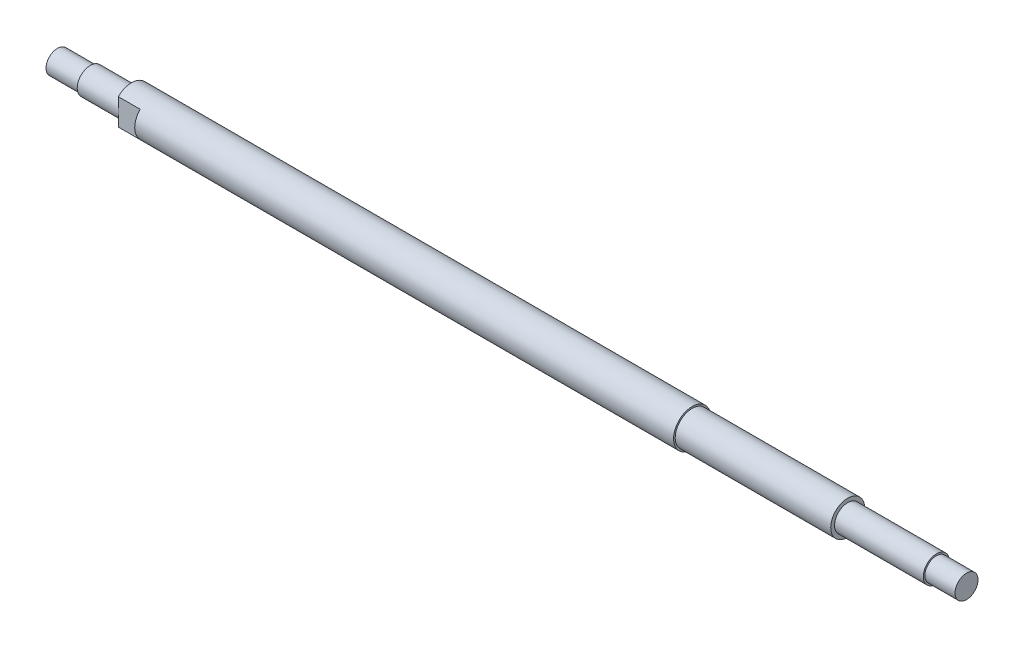
from build123d import *

# Parameters (mm, degrees)
CUT_EXTRUDE1_REACH             = 162.072
SKETCH2_W                      = 4
SKETCH2_H                      = 1
CUT_EXTRUDE1_DIRECTION_2_REACH = 162.072


with BuildPart() as part:
    # Sketch1 → Revolve1 (revolve)
    with BuildSketch(Plane(origin=(0, 0, 0), x_dir=(1, 0, 0), z_dir=(0, 1, 0)), mode=Mode.PRIVATE) as revolve1_sk:
        Polygon((0, 2.4), (0, 2.1), (-6, 2.1), (-6, 0), (160, 0), (160, 2.1), (154.5, 2.1), (154.5, 2.4), (138.3, 2.4), (138.3, 3.1), (109.9, 3.1), (109.9, 3.4), (7.5, 3.4), (7.5, 2.4), align=None)
    revolve(revolve1_sk.sketch.rotate(Axis((-12.266501292, 0, 0), (1, 0, 0)), 180), axis=Axis((-12.266501292, 0, 0), (1, 0, 0)))

    # Sketch2 → Cut-Extrude1 (cut, up to next)
    with BuildSketch(Plane(origin=(0, 0, 0), x_dir=(1, 0, 0), z_dir=(0, 1, 0)), mode=Mode.PRIVATE) as cut_extrude1_sk1:
        with Locations((9.5, 2.9)):
            Rectangle(SKETCH2_W, SKETCH2_H)
    cut_extrude1_tool1 = extrude(cut_extrude1_sk1.sketch, amount=-CUT_EXTRUDE1_REACH, mode=Mode.PRIVATE) & part.part
    # Sketch2 → Cut-Extrude1 (cut, up to next)
    with BuildSketch(Plane(origin=(0, 0, 0), x_dir=(1, 0, 0), z_dir=(0, 1, 0)), mode=Mode.PRIVATE) as cut_extrude1_sk2:
        with Locations((9.5, -2.9)):
            Rectangle(SKETCH2_W, SKETCH2_H)
    cut_extrude1_tool2 = extrude(cut_extrude1_sk2.sketch, amount=-CUT_EXTRUDE1_REACH, mode=Mode.PRIVATE) & part.part
    add(cut_extrude1_tool1.solids().sort_by_distance((9.5, 0, -2.9))[0], mode=Mode.SUBTRACT)
    add(cut_extrude1_tool2.solids().sort_by_distance((9.5, 0, 2.9))[0], mode=Mode.SUBTRACT)

    # Sketch2 → Cut-Extrude1 direction 2 (cut, up to next)
    with BuildSketch(Plane(origin=(0, 0, 0), x_dir=(1, 0, 0), z_dir=(0, 1, 0)), mode=Mode.PRIVATE) as cut_extrude1_direction_2_sk1:
        with Locations((9.5, 2.9)):
            Rectangle(SKETCH2_W, SKETCH2_H)
    cut_extrude1_direction_2_tool1 = extrude(cut_extrude1_direction_2_sk1.sketch, amount=CUT_EXTRUDE1_DIRECTION_2_REACH, mode=Mode.PRIVATE) & part.part
    # Sketch2 → Cut-Extrude1 direction 2 (cut, up to next)
    with BuildSketch(Plane(origin=(0, 0, 0), x_dir=(1, 0, 0), z_dir=(0, 1, 0)), mode=Mode.PRIVATE) as cut_extrude1_direction_2_sk2:
        with Locations((9.5, -2.9)):
            Rectangle(SKETCH2_W, SKETCH2_H)
    cut_extrude1_direction_2_tool2 = extrude(cut_extrude1_direction_2_sk2.sketch, amount=CUT_EXTRUDE1_DIRECTION_2_REACH, mode=Mode.PRIVATE) & part.part
    add(cut_extrude1_direction_2_tool1.solids().sort_by_distance((9.5, 0, -2.9))[0], mode=Mode.SUBTRACT)
    add(cut_extrude1_direction_2_tool2.solids().sort_by_distance((9.5, 0, 2.9))[0], mode=Mode.SUBTRACT)


solid = part.part
